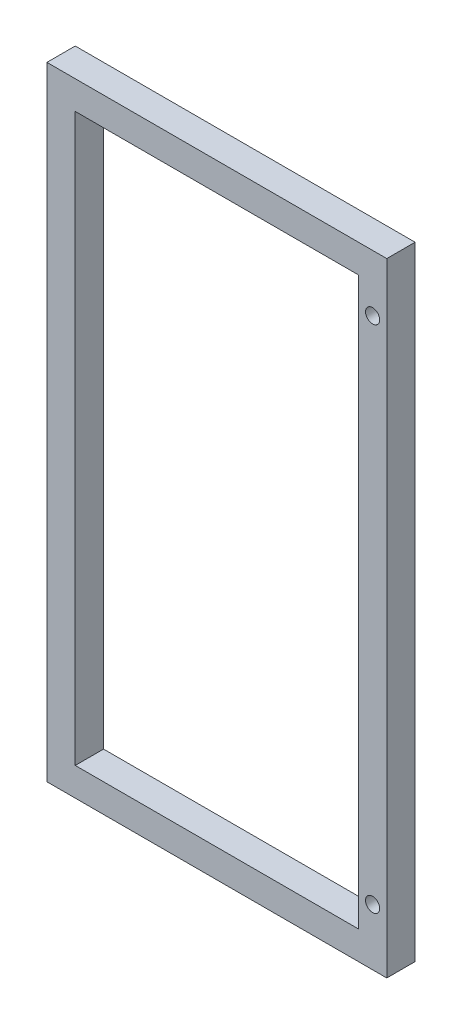
from build123d import *

# Parameters (mm, degrees)
SKETCH1_W           = 1200
SKETCH1_H           = 2200
SKETCH1_W_2         = 1000
SKETCH1_H_2         = 2000
BOSS_EXTRUDE1_DEPTH = 100
SKETCH2_R           = 25
CUT_EXTRUDE1_DEPTH  = 2373.762103541


with BuildPart() as part:
    # Sketch1 → Boss-Extrude1 (new body)
    with BuildSketch(Plane.XY):
        with Locations((500, 1000)):
            Rectangle(SKETCH1_W, SKETCH1_H)
        with Locations((500, 1000)):
            Rectangle(SKETCH1_W_2, SKETCH1_H_2, mode=Mode.SUBTRACT)
    extrude(amount=BOSS_EXTRUDE1_DEPTH)

    # Sketch2 → Cut-Extrude1 (cut, through all)
    with BuildSketch(Plane.XY.offset(100)):
        with Locations((1050, 1900)):
            Circle(SKETCH2_R)
        with Locations((1050, 100)):
            Circle(SKETCH2_R)
    extrude(amount=-CUT_EXTRUDE1_DEPTH, mode=Mode.SUBTRACT)


solid = part.part
